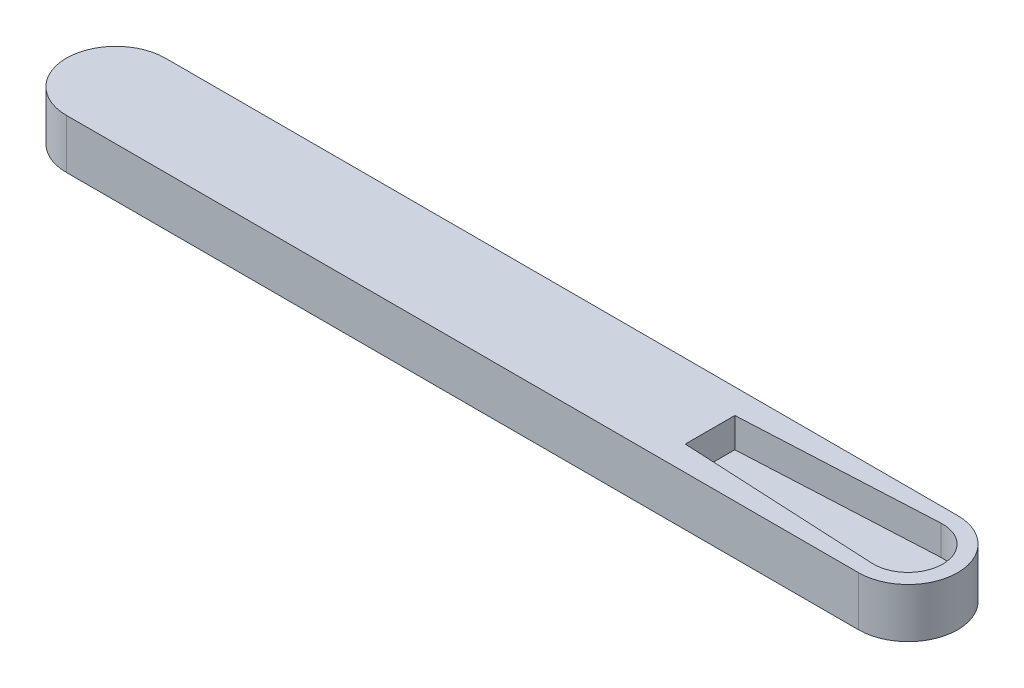
from build123d import *

# Parameters (mm, degrees)
Y_KSEKLIK_EKSTR_ZYON1_DEPTH = 5
Y_KSEKLIK_EKSTR_ZYON2_DEPTH = 2


with BuildPart() as part:
    # Çizim1 → Yükseklik-Ekstrüzyon1 (new body)
    with BuildSketch(Plane(origin=(0, 0, 0), x_dir=(1, 0, 0), z_dir=(0, 1, 0))):
        with BuildLine():
            Line((80, 5), (0, 5))
            ThreePointArc((0, 5), (-5, 0), (0, -5))
            Line((0, -5), (80, -5))
            ThreePointArc((80, -5), (85, 0), (80, 5))
        make_face()
        with BuildLine():
            Line((60, 2.5), (79.824449331, 3.495594651))
            ThreePointArc((79.824449331, 3.495594651), (83.5, 0), (79.824449331, -3.495594651))
            Line((79.824449331, -3.495594651), (60, -2.5))
            Line((60, -2.5), (60, 2.5))
        make_face(mode=Mode.SUBTRACT)
    extrude(amount=Y_KSEKLIK_EKSTR_ZYON1_DEPTH)

    # Çizim1<4> → Yükseklik-Ekstrüzyon2 (add)
    with BuildSketch(Plane(origin=(0, 0, 0), x_dir=(1, 0, 0), z_dir=(0, 1, 0))):
        with BuildLine():
            ThreePointArc((79.824449331, -3.495594651), (83.5, 0), (79.824449331, 3.495594651))
            Line((79.824449331, 3.495594651), (60, 2.5))
            Line((60, 2.5), (60, -2.5))
            Line((60, -2.5), (79.824449331, -3.495594651))
        make_face()
    extrude(amount=Y_KSEKLIK_EKSTR_ZYON2_DEPTH)


solid = part.part
